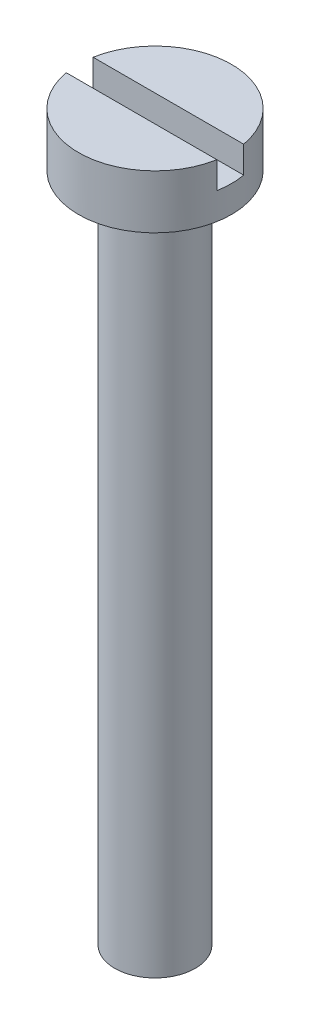
from build123d import *

# Parameters (mm, degrees)
SKETCH1_R           = 2.85
BOSS_EXTRUDE1_DEPTH = 2
SKETCH2_R           = 1.5
BOSS_EXTRUDE2_DEPTH = 25
SKETCH3_W           = 6
SKETCH3_H           = 1
CUT_EXTRUDE1_DEPTH  = 1


with BuildPart() as part:
    # Sketch1 → Boss-Extrude1 (new body)
    with BuildSketch(Plane(origin=(0, 0, 0), x_dir=(1, 0, 0), z_dir=(0, 1, 0))):
        with Locations(Location((0, 0, 0), (0, 0, 270))):
            Circle(SKETCH1_R)
    extrude(amount=BOSS_EXTRUDE1_DEPTH)

    # Sketch2 → Boss-Extrude2 (add)
    with BuildSketch(Plane(origin=(0, 0, 0), x_dir=(1, 0, 0), z_dir=(0, 1, 0))):
        with Locations(Location((0, 0, 0), (0, 0, 270))):
            Circle(SKETCH2_R)
    extrude(amount=-BOSS_EXTRUDE2_DEPTH)

    # Sketch3 → Cut-Extrude1 (cut)
    with BuildSketch(Plane(origin=(0, 2, 0), x_dir=(1, 0, 0), z_dir=(0, 1, 0))):
        Rectangle(SKETCH3_W, SKETCH3_H)
    extrude(amount=-CUT_EXTRUDE1_DEPTH, mode=Mode.SUBTRACT)


solid = part.part
